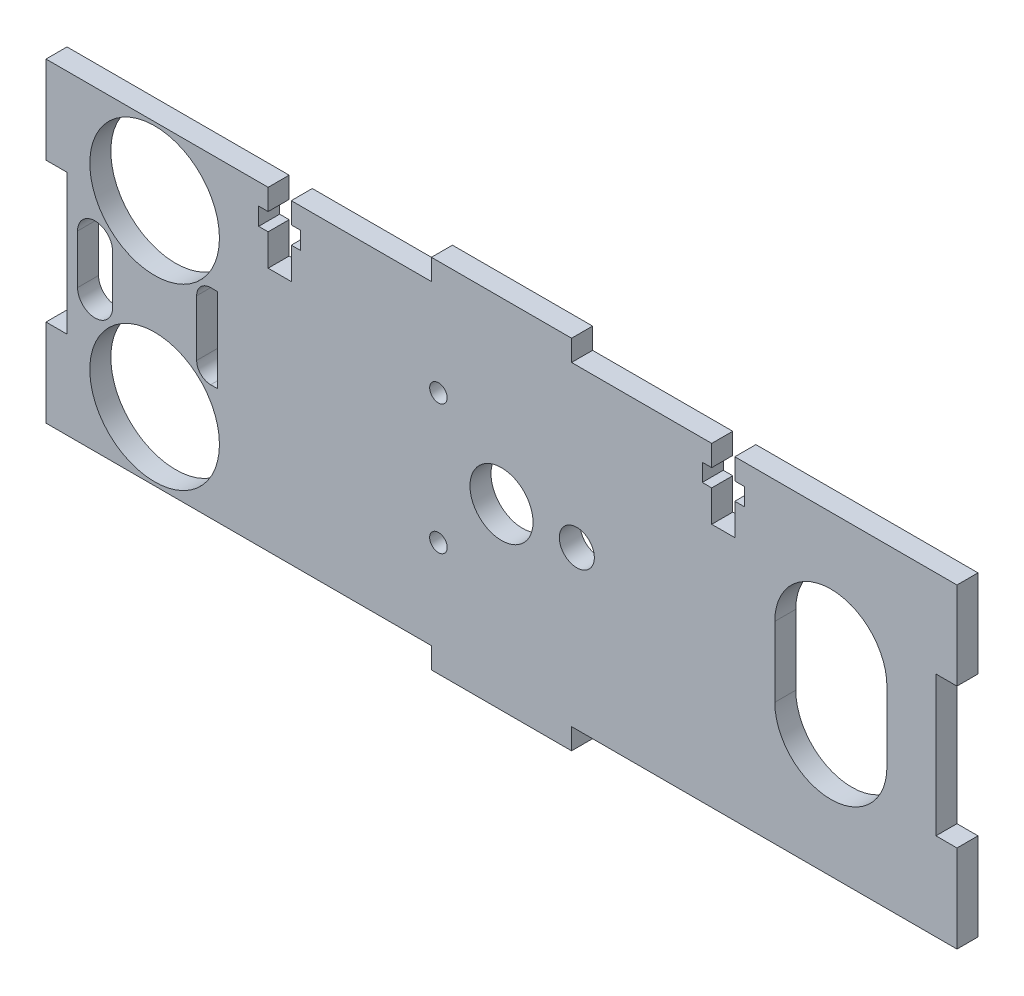
from build123d import *

# Parameters (mm, degrees)
SKETCH1_R           = 9.25
SKETCH1_R_2         = 4.5
SKETCH1_R_3         = 2.5
SKETCH1_R_4         = 1.25
BOSS_EXTRUDE1_DEPTH = 3


with BuildPart() as part:
    # Sketch1 → Boss-Extrude1 (new body)
    with BuildSketch(Plane.XY):
        Polygon((-10, -22.5), (-65, -22.5), (-65, -10), (-62, -10), (-62, 10), (-65, 10), (-65, 22.5), (-33.3, 22.5), (-33.3, 19.5), (-34.65, 19.5), (-34.65, 17), (-33.3, 17), (-33.3, 12.5), (-30, 12.5), (-30, 17), (-28.65, 17), (-28.65, 19.5), (-30, 19.5), (-30, 22.5), (-10, 22.5), (-10, 25.5), (10, 25.5), (10, 22.5), (30, 22.5), (30, 19.5), (28.65, 19.5), (28.65, 17), (30, 17), (30, 12.5), (33.3, 12.5), (33.3, 17), (34.65, 17), (34.65, 19.5), (33.3, 19.5), (33.3, 22.5), (65, 22.5), (65, 10), (62, 10), (62, -10), (65, -10), (65, -22.5), (10, -22.5), (10, -25.5), (-10, -25.5), align=None)
        with Locations((-49.5, 12.75)):
            Circle(SKETCH1_R, mode=Mode.SUBTRACT)
        with Locations((-49.5, -12.75)):
            Circle(SKETCH1_R, mode=Mode.SUBTRACT)
        Circle(SKETCH1_R_2, mode=Mode.SUBTRACT)
        with Locations((10.75, 0)):
            Circle(SKETCH1_R_3, mode=Mode.SUBTRACT)
        with Locations((-9, 9.25)):
            Circle(SKETCH1_R_4, mode=Mode.SUBTRACT)
        with Locations(Location((-9, -9.25, 0), (0, 0, 180))):
            Circle(SKETCH1_R_4, mode=Mode.SUBTRACT)
        with BuildLine():
            Line((-55.5, 3.5), (-55.5, -3.5))
            ThreePointArc((-55.5, -3.5), (-58, -6), (-60.5, -3.5))
            Line((-60.5, -3.5), (-60.5, 3.5))
            ThreePointArc((-60.5, 3.5), (-58, 6), (-55.5, 3.5))
        make_face(mode=Mode.SUBTRACT)
        with BuildLine():
            Line((-40.5, -6), (-41.5, -6))
            ThreePointArc((-41.5, -6), (-42.914213562, -5.414213562), (-43.5, -4))
            Line((-43.5, -4), (-43.5, 4))
            ThreePointArc((-43.5, 4), (-42.914213562, 5.414213562), (-41.5, 6))
            Line((-41.5, 6), (-40.5, 6))
            Line((-40.5, 6), (-40.5, -6))
        make_face(mode=Mode.SUBTRACT)
        with BuildLine():
            Line((39, -5), (39, 5))
            ThreePointArc((39, 5), (47, 13), (55, 5))
            Line((55, 5), (55, -5))
            ThreePointArc((55, -5), (47, -13), (39, -5))
        make_face(mode=Mode.SUBTRACT)
    extrude(amount=BOSS_EXTRUDE1_DEPTH)


solid = part.part
